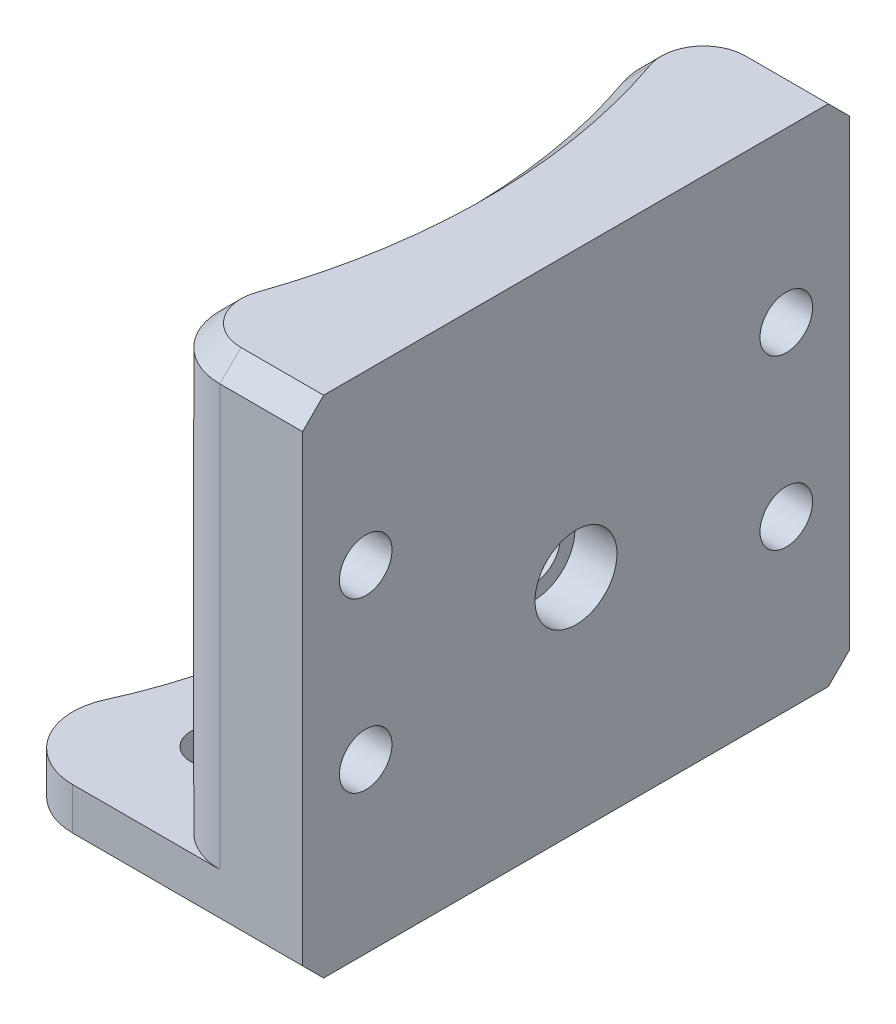
from build123d import *

# Parameters (mm, degrees)
SKETCH_1_R          = 1.25
EXTRUDE_1_DEPTH     = 24
SKETCH_2_R          = 27.5
CUT_EXTRUDE_1_DEPTH = 21
FILLET_1_R          = 3
SKETCH_3_R          = 1.25
CUT_EXTRUDE_2_DEPTH = 31.645010485
CHAMFER_2_SIZE      = 1
CUT_EXTRUDE_3_DEPTH = 29.75
SKETCH_5_R          = 1.95
CUT_EXTRUDE_4_DEPTH = 2
SKETCH_6_R          = 1.95
CUT_EXTRUDE_5_DEPTH = 1


with BuildPart() as part:
    # Эскиз1 → Бобышка-Вытянуть1 (new body)
    with BuildSketch(Plane(origin=(0, 0, 0), x_dir=(1, 0, 0), z_dir=(0, 1, 0))):
        with BuildLine():
            Line((32.75, 13), (16.492422502, 13))
            ThreePointArc((16.492422502, 13), (19.841129914, 6.879648517), (21, 0))
            ThreePointArc((21, 0), (19.841129914, -6.879648517), (16.492422502, -13))
            Line((16.492422502, -13), (32.75, -13))
            Line((32.75, -13), (32.75, 13))
        make_face()
        with Locations(Location((23.685438565, -8, 0), (0, 0, 270))):
            Circle(SKETCH_1_R, mode=Mode.SUBTRACT)
        with Locations(Location((23.685438565, 8, 0), (0, 0, 270))):
            Circle(SKETCH_1_R, mode=Mode.SUBTRACT)
    extrude(amount=EXTRUDE_1_DEPTH)

    # Эскиз2 → Вырез-Вытянуть1 (cut)
    with BuildSketch(Plane(origin=(0, 24, 0), x_dir=(1, 0, 0), z_dir=(0, 1, 0))):
        Circle(SKETCH_2_R)
    extrude(amount=-CUT_EXTRUDE_1_DEPTH, mode=Mode.SUBTRACT)

    # Скругление1
    fillet_1_edges = [part.edges().sort_by_distance(p)[0] for p in [
        (16.492422502, 1.5, -13),
        (16.492422502, 1.5, 13),
        (24.233241632, 13.5, 13),
        (24.233241632, 13.5, -13),
    ]]
    fillet(fillet_1_edges, radius=FILLET_1_R)

    # Эскиз3 → Вырез-Вытянуть2 (cut, through all)
    with BuildSketch(Plane(origin=(32.75, 0, 0), x_dir=(0, 0, -1), z_dir=(1, 0, 0))):
        with Locations((0, 10.5)):
            Circle(SKETCH_3_R)
        with Locations((-10, 16)):
            Circle(SKETCH_3_R)
        with Locations((-10, 8)):
            Circle(SKETCH_3_R)
        with Locations(Location((10, 8, 0), (0, 0, 141.895375662))):
            Circle(SKETCH_3_R)
        with Locations(Location((10, 16, 0), (0, 0, 141.895375662))):
            Circle(SKETCH_3_R)
    extrude(amount=-CUT_EXTRUDE_2_DEPTH, mode=Mode.SUBTRACT)

    # Фаска2
    chamfer_2_edges = [part.edges().sort_by_distance(p)[0] for p in [
        (30.782029534, 24, 13),
        (27.283712115, 0, 13),
        (27.5, 24, 0),
        (30.782029534, 24, -13),
        (26.369593925, 24, -11.73913489),
        (26.369593925, 24, 11.73913489),
        (27.283712115, 0, -13),
        (21, 0, 0),
        (19.292547995, 0, 11.620185175),
        (19.292547995, 0, -11.620185175),
    ]]
    chamfer(chamfer_2_edges, length=CHAMFER_2_SIZE)

    # Эскиз4 → Вырез-Вытянуть3 (cut)
    with BuildSketch(Plane(origin=(0, 0, 0), x_dir=(0, 0, -1), z_dir=(1, 0, 0))):
        Polygon((-7.85, 14.758696921), (-7.85, 17.241303079), (-10, 18.482606158), (-12.15, 17.241303079), (-12.15, 14.758696921), (-10, 13.517393842), align=None)
        Polygon((-10, 10.482606158), (-7.85, 9.241303079), (-7.85, 6.758696921), (-10, 5.517393842), (-12.15, 6.758696921), (-12.15, 9.241303079), align=None)
        Polygon((7.85, 9.241303079), (7.85, 6.758696921), (10, 5.517393842), (12.15, 6.758696921), (12.15, 9.241303079), (10, 10.482606158), align=None)
        Polygon((10, 13.517393842), (7.85, 14.758696921), (7.85, 17.241303079), (10, 18.482606158), (12.15, 17.241303079), (12.15, 14.758696921), align=None)
    extrude(amount=CUT_EXTRUDE_3_DEPTH, mode=Mode.SUBTRACT)

    # Эскиз5 → Вырез-Вытянуть4 (cut)
    with BuildSketch(Plane(origin=(32.75, 0, 0), x_dir=(0, 0, -1), z_dir=(1, 0, 0))):
        with Locations((0, 10.5)):
            Circle(SKETCH_5_R)
    extrude(amount=-CUT_EXTRUDE_4_DEPTH, mode=Mode.SUBTRACT)

    # Эскиз6 → Вырез-Вытянуть5 (cut)
    with BuildSketch(Plane.XZ):
        with Locations(Location((23.685438565, 8, 0), (0, 0, 270))):
            Circle(SKETCH_6_R)
        with Locations(Location((23.685438565, -8, 0), (0, 0, 270))):
            Circle(SKETCH_6_R)
    extrude(amount=-CUT_EXTRUDE_5_DEPTH, mode=Mode.SUBTRACT)


solid = part.part
